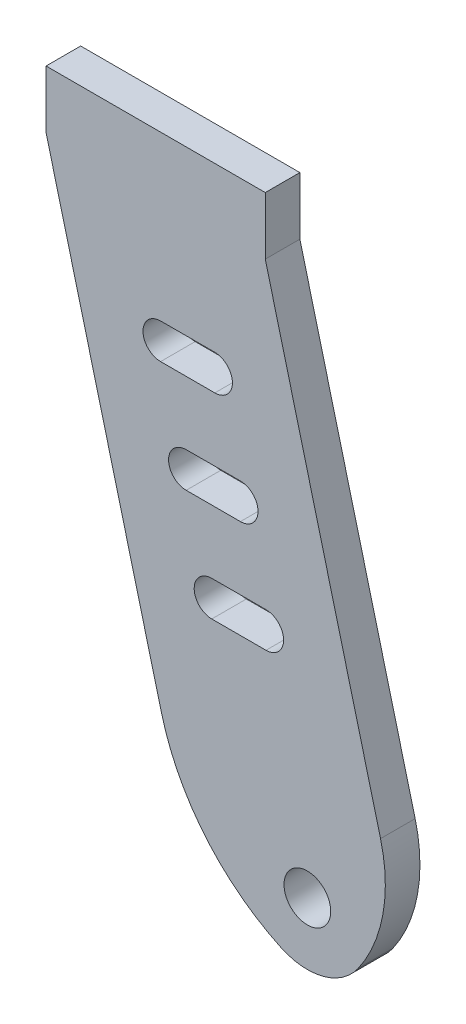
from build123d import *

# Parameters (mm, degrees)
SKETCH1_R           = 4.05
BOSS_EXTRUDE1_DEPTH = 6


with BuildPart() as part:
    # Sketch1 → Boss-Extrude1 (new body)
    with BuildSketch(Plane.XY):
        with BuildLine():
            Line((0, 0), (38, 0))
            Line((38, 0), (38, -10))
            Line((38, -10), (57.980052552, -87))
            ThreePointArc((57.980052552, -87), (58.395271252, -98.14362649), (54.093497988, -108.431851056))
            ThreePointArc((54.093497988, -108.431851056), (48.062167082, -112.638750827), (40.737765228, -111.984460623))
            ThreePointArc((40.737765228, -111.984460623), (27.569508693, -101.809733527), (19.980052552, -87))
            Line((19.980052552, -87), (0, -10))
            Line((0, -10), (0, 0))
        make_face()
        with Locations((45.2987713, -102.25)):
            Circle(SKETCH1_R, mode=Mode.SUBTRACT)
        with BuildLine():
            Line((24.290026276, -45.45), (33.690026276, -45.45))
            ThreePointArc((33.690026276, -45.45), (36.740026276, -48.5), (33.690026276, -51.55))
            Line((33.690026276, -51.55), (24.290026276, -51.55))
            ThreePointArc((24.290026276, -51.55), (21.240026276, -48.5), (24.290026276, -45.45))
        make_face(mode=Mode.SUBTRACT)
        with BuildLine():
            Line((28.72715483, -62.55), (38.12715483, -62.55))
            ThreePointArc((38.12715483, -62.55), (41.17715483, -65.6), (38.12715483, -68.65))
            Line((38.12715483, -68.65), (28.72715483, -68.65))
            ThreePointArc((28.72715483, -68.65), (25.67715483, -65.6), (28.72715483, -62.55))
        make_face(mode=Mode.SUBTRACT)
        with BuildLine():
            Line((19.852897722, -28.35), (29.252897722, -28.35))
            ThreePointArc((29.252897722, -28.35), (32.302897722, -31.4), (29.252897722, -34.45))
            Line((29.252897722, -34.45), (19.852897722, -34.45))
            ThreePointArc((19.852897722, -34.45), (16.802897722, -31.4), (19.852897722, -28.35))
        make_face(mode=Mode.SUBTRACT)
    extrude(amount=BOSS_EXTRUDE1_DEPTH)


solid = part.part
